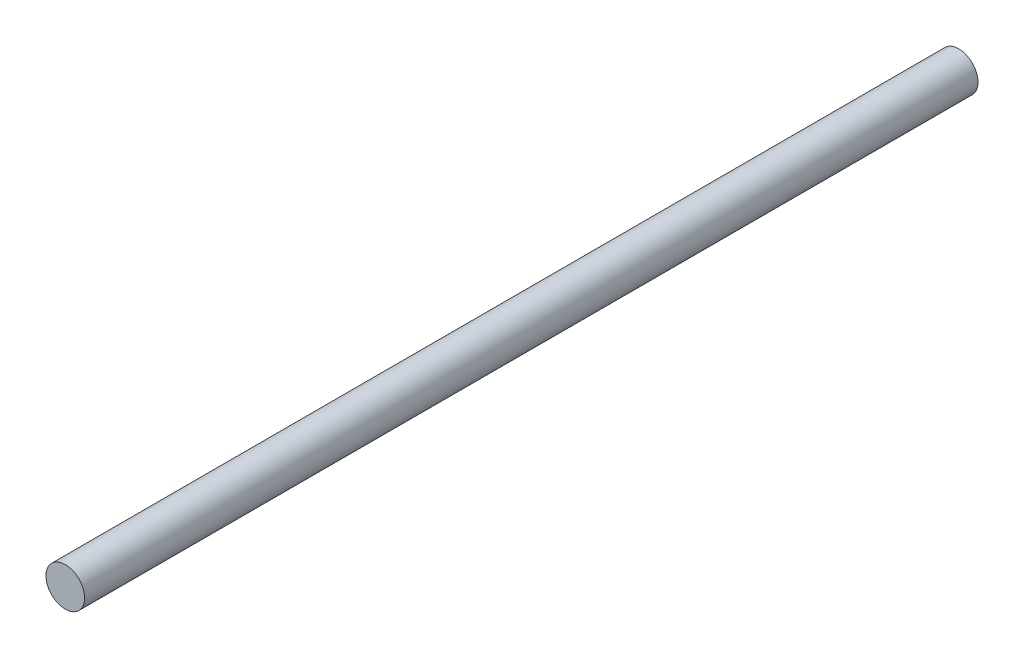
from build123d import *

# Parameters (mm, degrees)
SKETCH1_R           = 4
BOSS_EXTRUDE1_DEPTH = 185


with BuildPart() as part:
    # Sketch1 → Boss-Extrude1 (new body)
    with BuildSketch(Plane.XY):
        with Locations((-5.987136889, 4.964489284)):
            Circle(SKETCH1_R)
    extrude(amount=BOSS_EXTRUDE1_DEPTH)


solid = part.part
